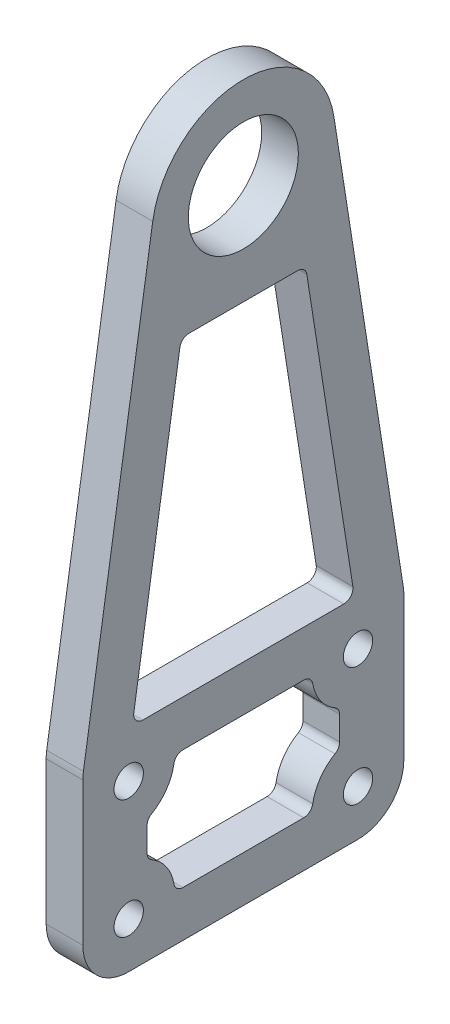
from build123d import *

# Parameters (mm, degrees)
SKETCH_1_R          = 6
SKETCH_1_R_2        = 1.6
EXTRUDE_1_DEPTH     = 4
CUT_EXTRUDE_2_DEPTH = 71.329581259
FILLET_1_R          = 5


with BuildPart() as part:
    # 草图1 → 凸台-拉伸1 (new body)
    with BuildSketch(Plane(origin=(0, 0, 0), x_dir=(0, 0, -1), z_dir=(1, 0, 0))):
        with BuildLine():
            Line((-17.5, -47), (-17.5, -68))
            Line((-17.5, -68), (17.5, -68))
            Line((17.5, -68), (17.5, -47))
            Line((17.5, -47), (9.879034185, 1.550704218))
            ThreePointArc((9.879034185, 1.550704218), (0, 10), (-9.879034185, 1.550704218))
            Line((-9.879034185, 1.550704218), (-17.5, -47))
        make_face()
        Circle(SKETCH_1_R, mode=Mode.SUBTRACT)
        with Locations((-12.5, -50)):
            Circle(SKETCH_1_R_2, mode=Mode.SUBTRACT)
        with Locations((12.5, -50)):
            Circle(SKETCH_1_R_2, mode=Mode.SUBTRACT)
        with Locations((-12.5, -63)):
            Circle(SKETCH_1_R_2, mode=Mode.SUBTRACT)
        with Locations((12.5, -63)):
            Circle(SKETCH_1_R_2, mode=Mode.SUBTRACT)
    extrude(amount=EXTRUDE_1_DEPTH)

    # 草图3 → 切除-拉伸2 (cut, through all)
    with BuildSketch(Plane(origin=(4, 0, 0), x_dir=(0, 0, -1), z_dir=(1, 0, 0))):
        with BuildLine():
            Line((-6.920512772, -11.844929578), (-11.943527577, -43.844929578))
            ThreePointArc((-11.943527577, -43.844929578), (-11.715581533, -44.649972914), (-10.955624159, -45))
            Line((-10.955624159, -45), (10.955624159, -45))
            ThreePointArc((10.955624159, -45), (11.715581533, -44.649972914), (11.943527577, -43.844929578))
            Line((11.943527577, -43.844929578), (6.920512772, -11.844929578))
            ThreePointArc((6.920512772, -11.844929578), (6.582582268, -11.240042626), (5.932609354, -11))
            Line((5.932609354, -11), (-5.932609354, -11))
            ThreePointArc((-5.932609354, -11), (-6.582582268, -11.240042626), (-6.920512772, -11.844929578))
        make_face()
        with BuildLine():
            Line((-10.5, -55.196152423), (-10.5, -57.803847577))
            ThreePointArc((-10.5, -57.803847577), (-10.366025404, -58.303847577), (-10, -58.669872981))
            ThreePointArc((-10, -58.669872981), (-8.394106246, -60.146644697), (-7.569933514, -62.166666667))
            ThreePointArc((-7.569933514, -62.166666667), (-7.229417441, -62.763762616), (-6.583920217, -63))
            Line((-6.583920217, -63), (6.583920217, -63))
            ThreePointArc((6.583920217, -63), (7.229417441, -62.763762616), (7.569933514, -62.166666667))
            ThreePointArc((7.569933514, -62.166666667), (8.394106246, -60.146644697), (10, -58.669872981))
            ThreePointArc((10, -58.669872981), (10.366025404, -58.303847577), (10.5, -57.803847577))
            Line((10.5, -57.803847577), (10.5, -55.196152423))
            ThreePointArc((10.5, -55.196152423), (10.366025404, -54.696152423), (10, -54.330127019))
            ThreePointArc((10, -54.330127019), (8.394106246, -52.853355303), (7.569933514, -50.833333333))
            ThreePointArc((7.569933514, -50.833333333), (7.229417441, -50.236237384), (6.583920217, -50))
            Line((6.583920217, -50), (-6.583920217, -50))
            ThreePointArc((-6.583920217, -50), (-7.229417441, -50.236237384), (-7.569933514, -50.833333333))
            ThreePointArc((-7.569933514, -50.833333333), (-8.394106246, -52.853355303), (-10, -54.330127019))
            ThreePointArc((-10, -54.330127019), (-10.366025404, -54.696152423), (-10.5, -55.196152423))
        make_face()
    extrude(amount=-CUT_EXTRUDE_2_DEPTH, mode=Mode.SUBTRACT)

    # 圆角1
    fillet_1_edges = [part.edges().sort_by_distance(p)[0] for p in [
        (2, -47, -17.5),
        (2, -68, -17.5),
        (2, -68, 17.5),
        (2, -47, 17.5),
    ]]
    fillet(fillet_1_edges, radius=FILLET_1_R)


solid = part.part
